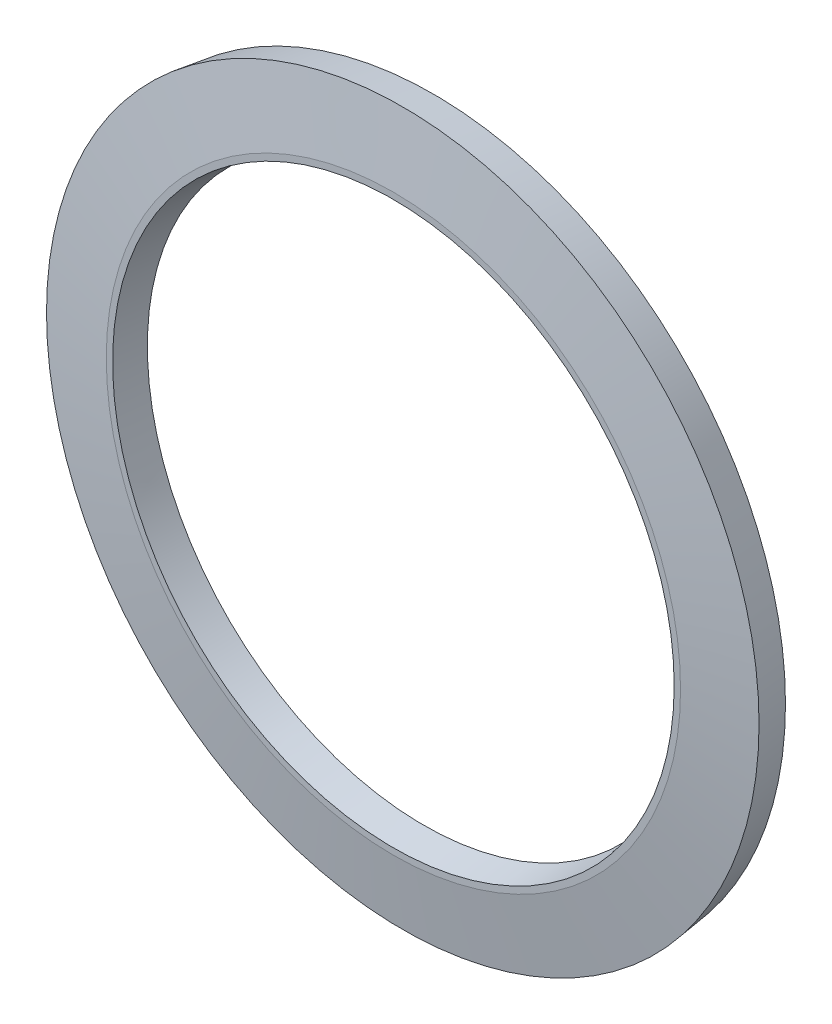
from build123d import *


with BuildPart() as part:
    # Sketch1 → Revolve1 (revolve)
    with BuildSketch(Plane(origin=(0, 0, 0), x_dir=(0, 0, -1), z_dir=(1, 0, 0)), mode=Mode.PRIVATE) as revolve1_sk:
        Polygon((1.478675638, 56.15), (6.3, 55.495688442), (6.3, 54.495688442), (4.821324362, 43.6), (0, 44.254311558), (0, 45.254311558), align=None)
    revolve(revolve1_sk.sketch.rotate(Axis((0, 0, 0), (0, 0, -1)), 90), axis=Axis((0, 0, 0), (0, 0, -1)))


solid = part.part
